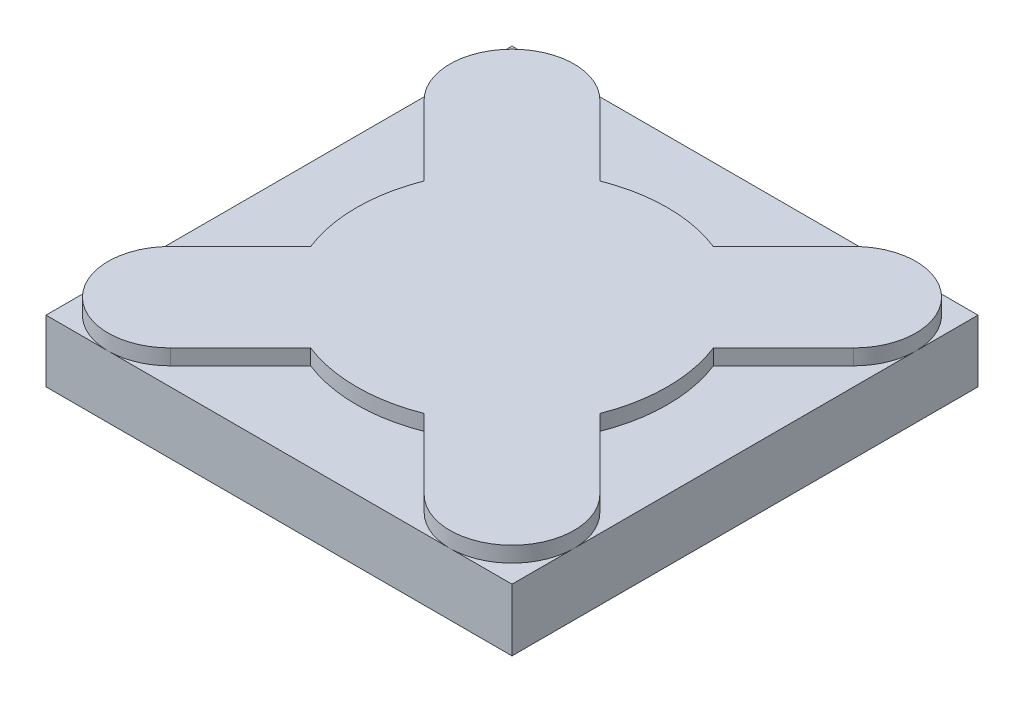
from build123d import *

# Parameters (mm, degrees)
SKETCH3_W           = 38.1
SKETCH3_H           = 38.1
BOSS_EXTRUDE2_DEPTH = 5.08
BOSS_EXTRUDE3_DEPTH = 1.27


with BuildPart() as part:
    # Sketch3 → Boss-Extrude2 (new body)
    with BuildSketch(Plane(origin=(0, 0, 0), x_dir=(1, 0, 0), z_dir=(0, 1, 0))):
        Rectangle(SKETCH3_W, SKETCH3_H)
    extrude(amount=-BOSS_EXTRUDE2_DEPTH)

    # Sketch2 → Boss-Extrude3 (add)
    with BuildSketch(Plane(origin=(0, 0, 0), x_dir=(1, 0, 0), z_dir=(0, 1, 0))):
        with BuildLine():
            Line((-17.562102448, 10.377897552), (-11.822643135, 4.638438239))
            ThreePointArc((-11.822643135, 4.638438239), (-12.7, 0), (-11.822643135, -4.638438239))
            Line((-11.822643135, -4.638438239), (-17.562102448, -10.377897552))
            ThreePointArc((-17.562102448, -10.377897552), (-17.562102448, -17.562102448), (-10.377897552, -17.562102448))
            Line((-10.377897552, -17.562102448), (-4.638438239, -11.822643135))
            ThreePointArc((-4.638438239, -11.822643135), (0, -12.7), (4.638438239, -11.822643135))
            Line((4.638438239, -11.822643135), (10.377897552, -17.562102448))
            ThreePointArc((10.377897552, -17.562102448), (17.562102448, -17.562102448), (17.562102448, -10.377897552))
            Line((17.562102448, -10.377897552), (11.822643135, -4.638438239))
            ThreePointArc((11.822643135, -4.638438239), (12.7, 0), (11.822643135, 4.638438239))
            Line((11.822643135, 4.638438239), (17.562102448, 10.377897552))
            ThreePointArc((17.562102448, 10.377897552), (17.562102448, 17.562102448), (10.377897552, 17.562102448))
            Line((10.377897552, 17.562102448), (4.638438239, 11.822643135))
            ThreePointArc((4.638438239, 11.822643135), (0, 12.7), (-4.638438239, 11.822643135))
            Line((-4.638438239, 11.822643135), (-10.377897552, 17.562102448))
            ThreePointArc((-10.377897552, 17.562102448), (-17.562102448, 17.562102448), (-17.562102448, 10.377897552))
        make_face()
    extrude(amount=BOSS_EXTRUDE3_DEPTH)


solid = part.part
